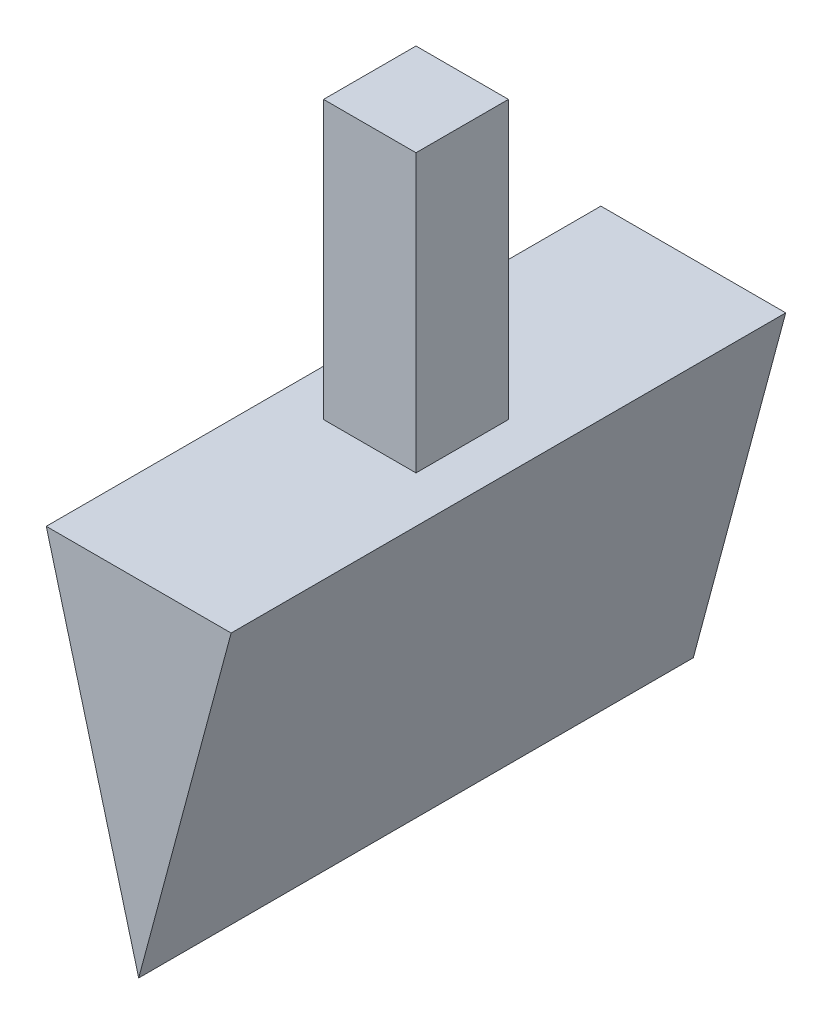
from build123d import *

# Parameters (mm, degrees)
BOSS_EXTRU_1_DEPTH = 12
ESQUISSE2_W        = 2
ESQUISSE2_H        = 2
BOSS_EXTRU_2_DEPTH = 6


with BuildPart() as part:
    # Esquisse1 → Boss.-Extru.1 (new body)
    with BuildSketch(Plane.XY):
        Polygon((0, 0), (-2, 7.464101615), (2, 7.464101615), align=None)
    extrude(amount=BOSS_EXTRU_1_DEPTH)

    # Esquisse2 → Boss.-Extru.2 (add)
    with BuildSketch(Plane(origin=(0, 7.464101615, 0), x_dir=(-1, 0, 0), z_dir=(0, 1, 0))):
        with Locations((0, 6)):
            Rectangle(ESQUISSE2_W, ESQUISSE2_H)
    extrude(amount=BOSS_EXTRU_2_DEPTH)


solid = part.part
